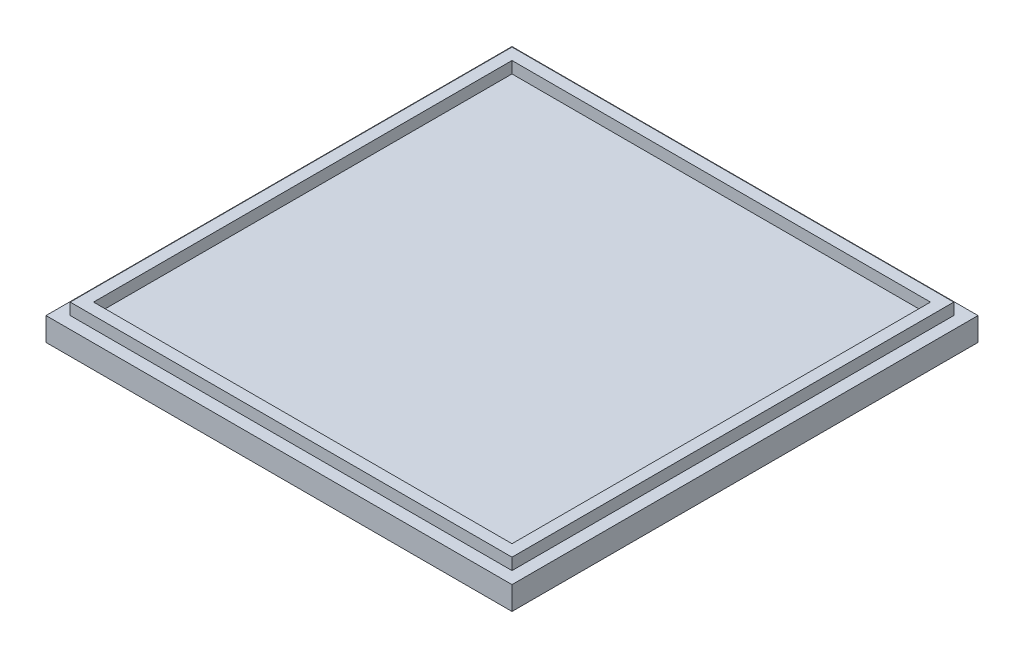
from build123d import *

# Parameters (mm, degrees)
CROQUIS1_W              = 200
CROQUIS1_H              = 200
SALIENTE_EXTRUIR1_DEPTH = 10
CROQUIS2_W              = 189.6
CROQUIS2_H              = 189.6
CROQUIS2_W_2            = 179.6
CROQUIS2_H_2            = 179.6
SALIENTE_EXTRUIR2_DEPTH = 5


with BuildPart() as part:
    # Croquis1 → Saliente-Extruir1 (new body)
    with BuildSketch(Plane(origin=(0, 0, 0), x_dir=(1, 0, 0), z_dir=(0, 1, 0))):
        Rectangle(CROQUIS1_W, CROQUIS1_H)
    extrude(amount=SALIENTE_EXTRUIR1_DEPTH)

    # Croquis2 → Saliente-Extruir2 (add)
    with BuildSketch(Plane(origin=(0, 10, 0), x_dir=(1, 0, 0), z_dir=(0, 1, 0))):
        Rectangle(CROQUIS2_W, CROQUIS2_H)
        Rectangle(CROQUIS2_W_2, CROQUIS2_H_2, mode=Mode.SUBTRACT)
    extrude(amount=SALIENTE_EXTRUIR2_DEPTH)


solid = part.part
